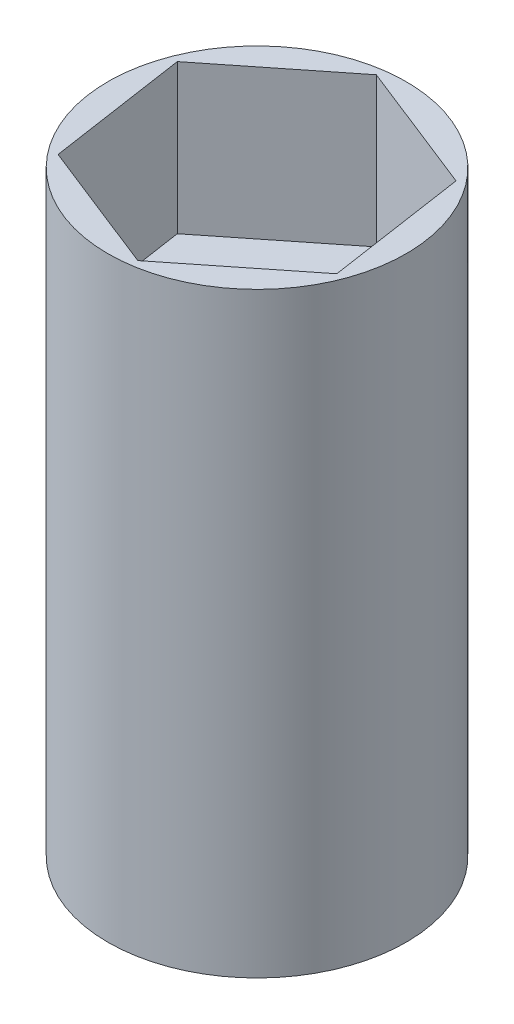
from build123d import *

# Parameters (mm, degrees)
SKETCH1_R           = 2
BOSS_EXTRUDE1_DEPTH = 8
CUT_EXTRUDE4_DEPTH  = 2


with BuildPart() as part:
    # Sketch1 → Boss-Extrude1 (new body)
    with BuildSketch(Plane(origin=(0, 0, 0), x_dir=(1, 0, 0), z_dir=(0, 1, 0))):
        with Locations(Location((0, 0, 0), (0, 0, 270))):
            Circle(SKETCH1_R)
    extrude(amount=BOSS_EXTRUDE1_DEPTH)

    # Sketch2 → Cut-Extrude4 (cut)
    with BuildSketch(Plane(origin=(0, 8, 0), x_dir=(1, 0, 0), z_dir=(0, 1, 0))):
        Polygon((-1.487825408, -1.181683357), (0.279455103, -1.879336278), (1.76728051, -0.697652921), (1.487825408, 1.181683357), (-0.279455103, 1.879336278), (-1.76728051, 0.697652921), align=None)
    extrude(amount=-CUT_EXTRUDE4_DEPTH, mode=Mode.SUBTRACT)


solid = part.part
